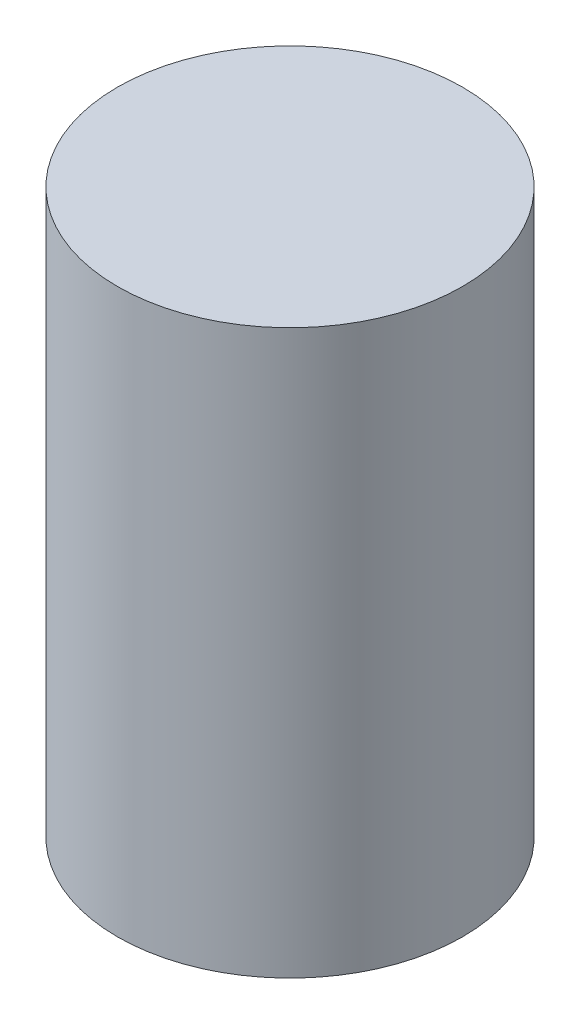
from build123d import *

# Parameters (mm, degrees)
SKETCH1_R           = 47.5
BOSS_EXTRUDE1_DEPTH = 155


with BuildPart() as part:
    # Sketch1 → Boss-Extrude1 (new body)
    with BuildSketch(Plane(origin=(0, 0, 0), x_dir=(1, 0, 0), z_dir=(0, 1, 0))):
        with Locations(Location((0, 0, 0), (0, 0, 270))):
            Circle(SKETCH1_R)
    extrude(amount=BOSS_EXTRUDE1_DEPTH)


solid = part.part
